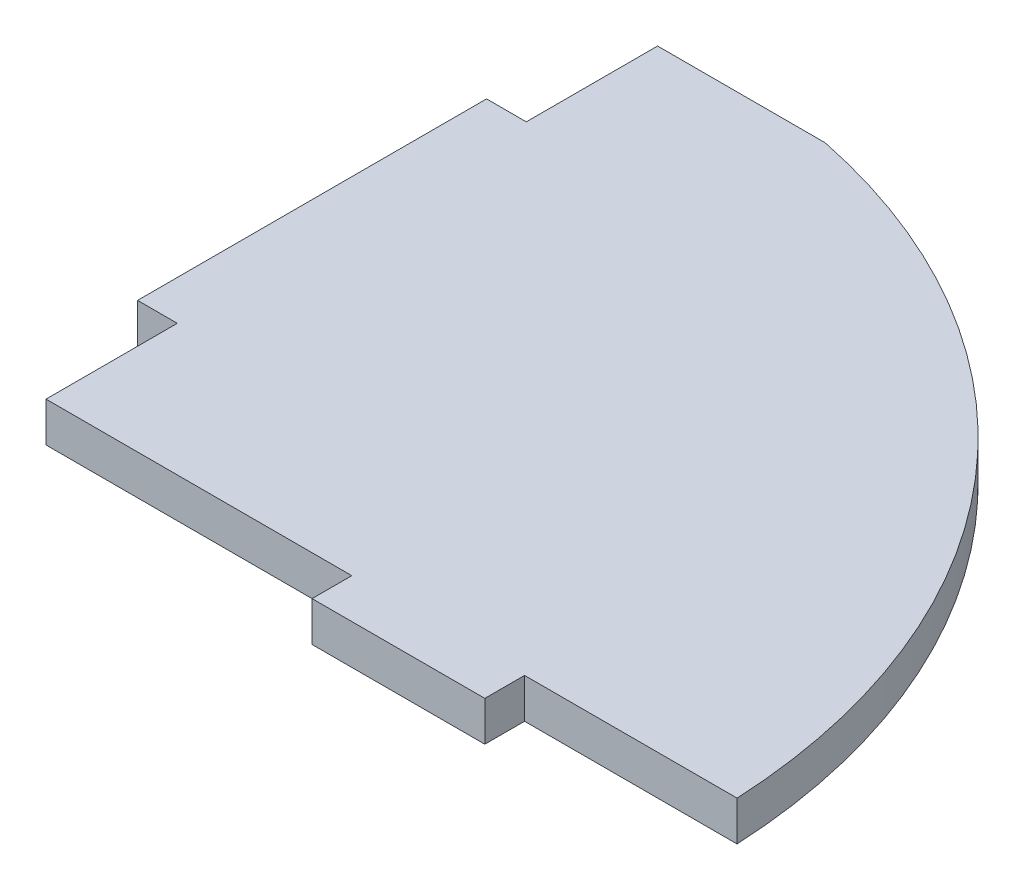
from build123d import *

# Parameters (mm, degrees)
BOSS_EXTRUDE1_DEPTH = 2.921


with BuildPart() as part:
    # Sketch2 → Boss-Extrude1 (new body)
    with BuildSketch(Plane(origin=(0, 0, 0), x_dir=(1, 0, 0), z_dir=(0, 1, 0))):
        with BuildLine():
            Line((35.179, 0), (50.8, 0))
            ThreePointArc((50.8, 0), (39.252334483, 29.06354477), (12.319, 44.958))
            Line((12.319, 44.958), (0, 44.958))
            Line((0, 44.958), (0, 35.306))
            Line((0, 35.306), (-2.921, 35.306))
            Line((-2.921, 35.306), (-2.921, 9.652))
            Line((-2.921, 9.652), (0, 9.652))
            Line((0, 9.652), (0, 0))
            Line((0, 0), (22.479, 0))
            Line((22.479, 0), (22.479, -2.921))
            Line((22.479, -2.921), (35.179, -2.921))
            Line((35.179, -2.921), (35.179, 0))
        make_face()
    extrude(amount=BOSS_EXTRUDE1_DEPTH)


solid = part.part
